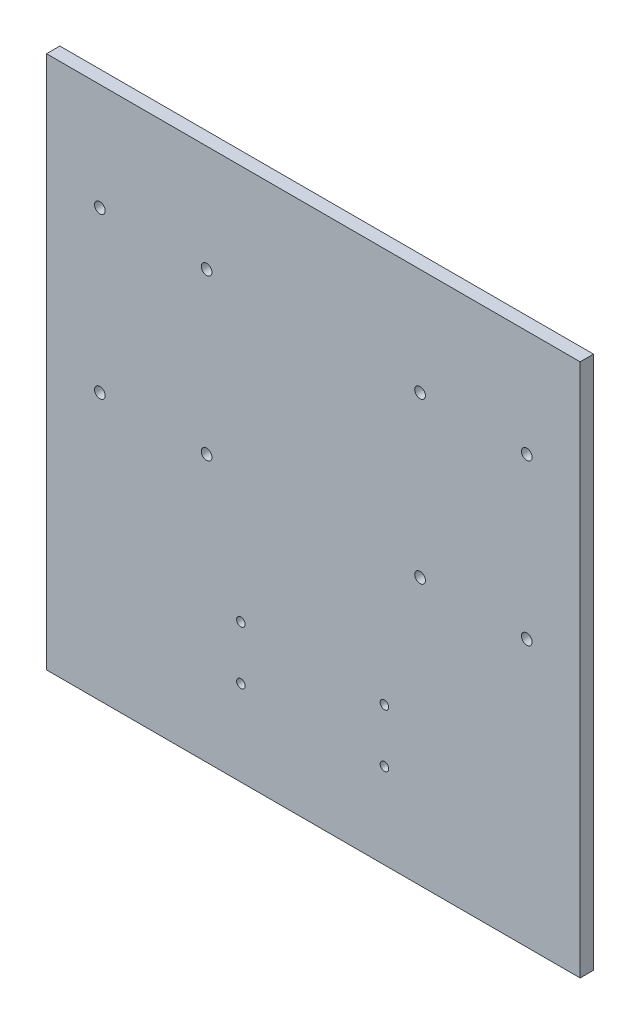
from build123d import *

# Parameters (mm, degrees)
ESQUISSE1_W             = 200
ESQUISSE1_H             = 200
BOSS_EXTRU_1_DEPTH      = 5
ESQUISSE8_R             = 1.6
ENL_V_MAT_EXTRU_2_DEPTH = 142.509716981
ESQUISSE10_R            = 2
ENL_V_MAT_EXTRU_4_DEPTH = 142.509716981


with BuildPart() as part:
    # Esquisse1 → Boss.-Extru.1 (new body)
    with BuildSketch(Plane.XY):
        Rectangle(ESQUISSE1_W, ESQUISSE1_H)
    extrude(amount=BOSS_EXTRU_1_DEPTH)

    # Esquisse8 → Enlèv. mat.-Extru.2 (cut, through all)
    with BuildSketch(Plane.XY.offset(5)):
        with Locations((-27.15, -68)):
            Circle(ESQUISSE8_R)
        with Locations((-27.15, -48)):
            Circle(ESQUISSE8_R)
        with Locations((26.65, -48)):
            Circle(ESQUISSE8_R)
        with Locations((26.65, -68)):
            Circle(ESQUISSE8_R)
    extrude(amount=-ENL_V_MAT_EXTRU_2_DEPTH, mode=Mode.SUBTRACT)

    # Esquisse10 → Enlèv. mat.-Extru.4 (cut, through all)
    with BuildSketch(Plane.XY.offset(5)):
        with Locations((-80, 60)):
            Circle(ESQUISSE10_R)
        with Locations((-40, 60)):
            Circle(ESQUISSE10_R)
        with Locations(Location((-40, 0, 0), (0, 0, 180))):
            Circle(ESQUISSE10_R)
        with Locations(Location((-80, 0, 0), (0, 0, 180))):
            Circle(ESQUISSE10_R)
        with Locations((80, 0)):
            Circle(ESQUISSE10_R)
        with Locations((40, 0)):
            Circle(ESQUISSE10_R)
        with Locations(Location((40, 60, 0), (0, 0, 180))):
            Circle(ESQUISSE10_R)
        with Locations(Location((80, 60, 0), (0, 0, 180))):
            Circle(ESQUISSE10_R)
    extrude(amount=-ENL_V_MAT_EXTRU_4_DEPTH, mode=Mode.SUBTRACT)


solid = part.part
